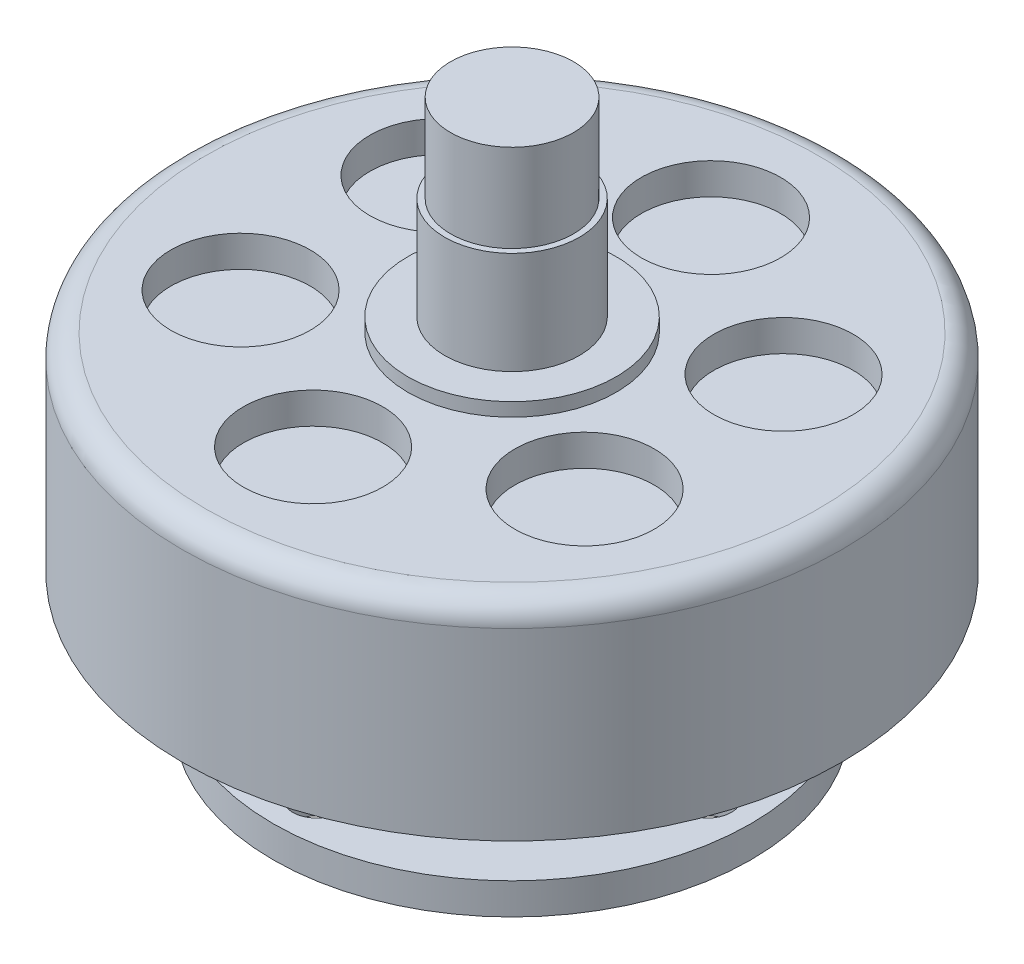
from build123d import *

# Parameters (mm, degrees)
CROQUIS1_R              = 21.05
SALIENTE_EXTRUIR1_DEPTH = 13.25
REDONDEO1_R             = 1.5
CROQUIS2_R              = 4.45
CORTAR_EXTRUIR1_DEPTH   = 2
CROQUIS3_R              = 3.925
SALIENTE_EXTRUIR2_DEPTH = 13
CROQUIS4_R              = 5.908652193
SALIENTE_EXTRUIR3_DEPTH = 6.3
CROQUIS5_R              = 15.25
CROQUIS5_R_2            = 1.5
SALIENTE_EXTRUIR4_DEPTH = 2
CROQUIS6_R              = 2
SALIENTE_EXTRUIR5_DEPTH = 2.7
CROQUIS7_R              = 3
SALIENTE_EXTRUIR6_DEPTH = 1.2
CROQUIS8_W              = 3.5
CROQUIS8_H              = 3.439508105
SALIENTE_EXTRUIR7_DEPTH = 0.2
CROQUIS9_R              = 4.3
SALIENTE_EXTRUIR8_DEPTH = 7.4
CROQUIS10_R             = 6.65
SALIENTE_EXTRUIR9_DEPTH = 0.86


with BuildPart() as part:
    # Croquis1 → Saliente-Extruir1 (new body)
    with BuildSketch(Plane(origin=(0, 0, 0), x_dir=(1, 0, 0), z_dir=(0, 1, 0))):
        with Locations(Location((0, 0, 0), (0, 0, 270))):
            Circle(CROQUIS1_R)
    extrude(amount=SALIENTE_EXTRUIR1_DEPTH)

    # Redondeo1
    redondeo1_edges = [part.edges().sort_by_distance(p)[0] for p in [
        (0, 13.25, -21.05),
    ]]
    fillet(redondeo1_edges, radius=REDONDEO1_R)

    # Croquis2 → Cortar-Extruir1 (cut)
    with BuildSketch(Plane(origin=(0, 13.25, 0), x_dir=(1, 0, 0), z_dir=(0, 1, 0))):
        with Locations(Location((0.010957244, 12.691225968, 0), (0, 0, 270))):
            Circle(CROQUIS2_R)
        with Locations(Location((10.996402716, 6.336123732, 0), (0, 0, 270))):
            Circle(CROQUIS2_R)
        with Locations(Location((10.985445471, -6.355102236, 0), (0, 0, 270))):
            Circle(CROQUIS2_R)
        with Locations(Location((-0.010957244, -12.691225968, 0), (0, 0, 270))):
            Circle(CROQUIS2_R)
        with Locations(Location((-10.996402716, -6.336123732, 0), (0, 0, 270))):
            Circle(CROQUIS2_R)
        with Locations(Location((-10.985445471, 6.355102236, 0), (0, 0, 270))):
            Circle(CROQUIS2_R)
    extrude(amount=-CORTAR_EXTRUIR1_DEPTH, mode=Mode.SUBTRACT)

    # Croquis3 → Saliente-Extruir2 (add)
    with BuildSketch(Plane(origin=(0, 13.25, 0), x_dir=(1, 0, 0), z_dir=(0, 1, 0))):
        with Locations(Location((0, 0, 0), (0, 0, 90))):
            Circle(CROQUIS3_R)
    extrude(amount=SALIENTE_EXTRUIR2_DEPTH)

    # Croquis4 → Saliente-Extruir3 (add)
    with BuildSketch(Plane.XZ):
        with Locations(Location((0, 0, 0), (0, 0, 90))):
            Circle(CROQUIS4_R)
    extrude(amount=SALIENTE_EXTRUIR3_DEPTH)

    # Croquis5 → Saliente-Extruir4 (add)
    with BuildSketch(Plane.XZ.offset(6.3)):
        with Locations(Location((0, 0, 0), (0, 0, 270))):
            Circle(CROQUIS5_R)
        with Locations(Location((0, 12.5, 0), (0, 0, 270))):
            Circle(CROQUIS5_R_2, mode=Mode.SUBTRACT)
        with Locations(Location((12.5, 0, 0), (0, 0, 270))):
            Circle(CROQUIS5_R_2, mode=Mode.SUBTRACT)
        with Locations(Location((0, -12.5, 0), (0, 0, 270))):
            Circle(CROQUIS5_R_2, mode=Mode.SUBTRACT)
        with Locations(Location((-12.5, 0, 0), (0, 0, 270))):
            Circle(CROQUIS5_R_2, mode=Mode.SUBTRACT)
    extrude(amount=SALIENTE_EXTRUIR4_DEPTH)

    # Croquis6 → Saliente-Extruir5 (add)
    with BuildSketch(Plane.XZ.offset(8.3)):
        with Locations(Location((0, 0, 0), (0, 0, 90))):
            Circle(CROQUIS6_R)
    extrude(amount=SALIENTE_EXTRUIR5_DEPTH)

    # Croquis7 → Saliente-Extruir6 (add)
    with BuildSketch(Plane.XZ.offset(8.3)):
        with Locations(Location((0, 0, 0), (0, 0, 270))):
            Circle(CROQUIS7_R)
    extrude(amount=SALIENTE_EXTRUIR6_DEPTH)

    # Croquis8 → Saliente-Extruir7 (add)
    with BuildSketch(Plane.XZ.offset(9.5)):
        with Locations((0, 1.730245948)):
            Rectangle(CROQUIS8_W, CROQUIS8_H)
    extrude(amount=SALIENTE_EXTRUIR7_DEPTH)

    # Croquis9 → Saliente-Extruir8 (add)
    with BuildSketch(Plane(origin=(0, 13.25, 0), x_dir=(1, 0, 0), z_dir=(0, 1, 0))):
        with Locations(Location((0, 0, 0), (0, 0, 270))):
            Circle(CROQUIS9_R)
    extrude(amount=SALIENTE_EXTRUIR8_DEPTH)

    # Croquis10 → Saliente-Extruir9 (add)
    with BuildSketch(Plane(origin=(0, 13.25, 0), x_dir=(1, 0, 0), z_dir=(0, 1, 0))):
        with Locations(Location((0, 0, 0), (0, 0, 270))):
            Circle(CROQUIS10_R)
    extrude(amount=SALIENTE_EXTRUIR9_DEPTH)


solid = part.part
